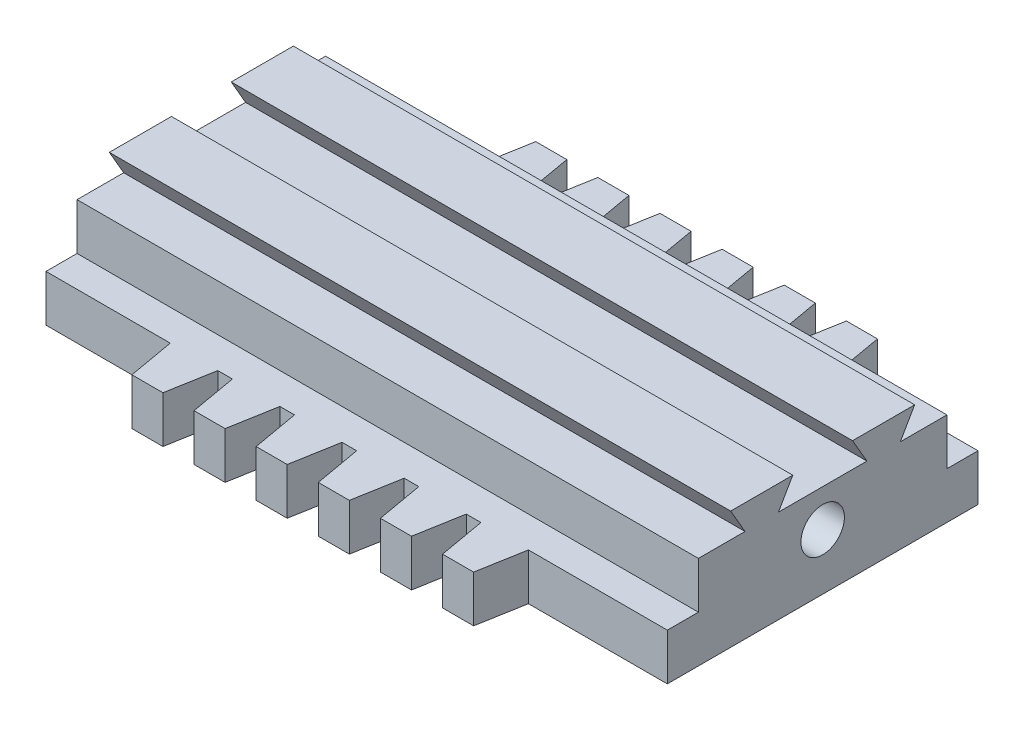
from build123d import *

# Parameters (mm, degrees)
BOSS_EXTRUDE1_DEPTH     = 15
SKETCH2_W               = 200
SKETCH2_H               = 80
BOSS_EXTRUDE2_DEPTH     = 15
BOSS_EXTRUDE3_DEPTH     = 200
CUT_EXTRUDE1_DEPTH      = 214.703065022
CUT_EXTRUDE1_DEPTH_BACK = 214.703065022
SKETCH4_R               = 7


with BuildPart() as part:
    # Sketch1 → Boss-Extrude1 (new body)
    with BuildSketch(Plane(origin=(0, 0, 0), x_dir=(1, 0, 0), z_dir=(0, 1, 0))):
        Polygon((-60, 50), (-57.355095289, 65), (-47.355095289, 65), (-44.710190579, 50), (-40, 50), (-37.355095289, 65), (-27.355095289, 65), (-24.710190579, 50), (-20, 50), (-17.355095289, 65), (-7.355095289, 65), (-4.710190579, 50), (0, 50), (2.644904711, 65), (12.644904711, 65), (15.289809421, 50), (20, 50), (22.644904711, 65), (32.644904711, 65), (35.289809421, 50), (40, 50), (42.644904711, 65), (52.644904711, 65), (55.289809421, 50), (100, 50), (100, -50), (55.289809421, -50), (52.644904711, -65), (42.644904711, -65), (40, -50), (35.289809421, -50), (32.644904711, -65), (22.644904711, -65), (20, -50), (15.289809421, -50), (12.644904711, -65), (2.644904711, -65), (0, -50), (-4.710190579, -50), (-7.355095289, -65), (-17.355095289, -65), (-20, -50), (-24.710190579, -50), (-27.355095289, -65), (-37.355095289, -65), (-40, -50), (-44.710190579, -50), (-47.355095289, -65), (-57.355095289, -65), (-60, -50), (-100, -50), (-100, 50), align=None)
    extrude(amount=BOSS_EXTRUDE1_DEPTH)

    # Sketch2 → Boss-Extrude2 (add)
    with BuildSketch(Plane(origin=(0, 15, 0), x_dir=(1, 0, 0), z_dir=(0, 1, 0))):
        Rectangle(SKETCH2_W, SKETCH2_H)
    extrude(amount=BOSS_EXTRUDE2_DEPTH)

    # Sketch3 → Boss-Extrude3 (add)
    with BuildSketch(Plane.ZY.offset(100)):
        Polygon((25, 30), (29.618802154, 38), (9.618802154, 38), (14.237604307, 30), align=None)
        Polygon((-25, 30), (-14.237604307, 30), (-9.618802154, 38), (-29.618802154, 38), align=None)
    extrude(amount=-BOSS_EXTRUDE3_DEPTH)

    # Sketch4 → Cut-Extrude1 (cut, two sides: drawn at the far end of the back side and taken through both)
    with BuildSketch(Plane.ZY.offset(100).offset(-CUT_EXTRUDE1_DEPTH_BACK)):
        with Locations((0, 18)):
            Circle(SKETCH4_R)
    extrude(amount=CUT_EXTRUDE1_DEPTH + CUT_EXTRUDE1_DEPTH_BACK, mode=Mode.SUBTRACT)


solid = part.part
